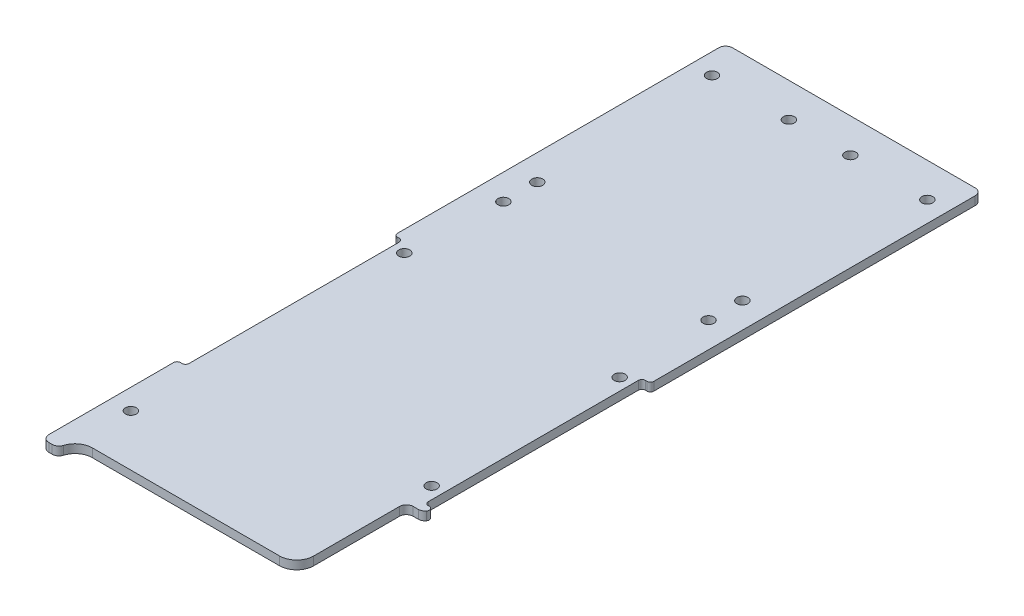
from build123d import *

# Parameters (mm, degrees)
SKETCH1_R               = 2.032
BOSS_EXTRUDE1_DEPTH     = 3.175
FILLET1_R               = 2.54
FILLET2_R               = 2.54
FILLET3_R               = 6.35
CUT_EXTRUDE1_DEPTH      = 136.673215063
FILLET4_R               = 6.35
FILLET5_R               = 2.54
SKETCH3_R               = 2.032
CUT_EXTRUDE2_DEPTH      = 136.673215063
CUT_EXTRUDE3_DEPTH      = 136.673215063
CUT_EXTRUDE3_DEPTH_BACK = 136.673215063
SKETCH4_W               = 3.175
SKETCH4_H               = 80.645
FILLET6_R               = 1.27


with BuildPart() as part:
    # Sketch1 → Boss-Extrude1 (new body)
    with BuildSketch(Plane(origin=(0, 0, 0), x_dir=(1, 0, 0), z_dir=(0, 1, 0))):
        Polygon((47.625, 127), (-47.625, 127), (-47.625, -127), (-41.275, -127), (-41.275, -120.65), (41.275, -120.65), (41.275, -127), (47.625, -127), align=None)
        with Locations(Location((-39.999684148, -101.6, 0), (0, 0, 270))):
            Circle(SKETCH1_R, mode=Mode.SUBTRACT)
        with Locations(Location((39.999684148, -69.85, 0), (0, 0, 270))):
            Circle(SKETCH1_R, mode=Mode.SUBTRACT)
        with Locations(Location((-39.999684148, 0, 0), (0, 0, 270))):
            Circle(SKETCH1_R, mode=Mode.SUBTRACT)
        with Locations(Location((-39.999684148, 114.3, 0), (0, 0, 270))):
            Circle(SKETCH1_R, mode=Mode.SUBTRACT)
        with Locations(Location((-11.424684148, 114.3, 0), (0, 0, 270))):
            Circle(SKETCH1_R, mode=Mode.SUBTRACT)
        with Locations(Location((39.999684148, 0, 0), (0, 0, 270))):
            Circle(SKETCH1_R, mode=Mode.SUBTRACT)
        with Locations(Location((11.424684148, 114.3, 0), (0, 0, 270))):
            Circle(SKETCH1_R, mode=Mode.SUBTRACT)
        with Locations(Location((39.999684148, 114.3, 0), (0, 0, 270))):
            Circle(SKETCH1_R, mode=Mode.SUBTRACT)
    extrude(amount=BOSS_EXTRUDE1_DEPTH)

    # Fillet1
    fillet1_edges = [part.edges().sort_by_distance(p)[0] for p in [
        (-47.625, 1.5875, 127),
        (-47.625, 1.5875, -127),
        (47.625, 1.5875, -127),
        (47.625, 1.5875, 127),
    ]]
    fillet(fillet1_edges, radius=FILLET1_R)

    # Fillet2
    fillet2_edges = [part.edges().sort_by_distance(p)[0] for p in [
        (-41.275, 1.5875, 127),
        (41.275, 1.5875, 127),
    ]]
    fillet(fillet2_edges, radius=FILLET2_R)

    # Fillet3
    fillet3_edges = [part.edges().sort_by_distance(p)[0] for p in [
        (41.275, 1.5875, 120.65),
        (-41.275, 1.5875, 120.65),
    ]]
    fillet(fillet3_edges, radius=FILLET3_R)

    # Sketch2 → Cut-Extrude1 (cut, through all)
    with BuildSketch(Plane.XZ):
        with BuildLine():
            Line((40.64508, 123.578690235), (40.64508, 79.88808))
            Line((40.64508, 79.88808), (47.625, 79.88808))
            Line((47.625, 79.88808), (47.625, 124.46))
            ThreePointArc((47.625, 124.46), (46.881051224, 126.256051224), (45.085, 127))
            Line((45.085, 127), (43.815, 127))
            ThreePointArc((43.815, 127), (42.297059666, 126.496530663), (41.380880287, 125.185714286))
            ThreePointArc((41.380880287, 125.185714286), (41.069166069, 124.356476684), (40.64508, 123.578690235))
        make_face()
    extrude(amount=-CUT_EXTRUDE1_DEPTH, mode=Mode.SUBTRACT)

    # Fillet4
    fillet4_edges = [part.edges().sort_by_distance(p)[0] for p in [
        (40.64508, 1.5875, 123.578690235),
    ]]
    fillet(fillet4_edges, radius=FILLET4_R)

    # Fillet5
    fillet5_edges = [part.edges().sort_by_distance(p)[0] for p in [
        (47.625, 1.5875, 79.88808),
        (40.64508, 1.5875, 79.88808),
    ]]
    fillet(fillet5_edges, radius=FILLET5_R)

    # Sketch3 → Cut-Extrude2 (cut, through all)
    with BuildSketch(Plane.XZ):
        with Locations(Location((-38.103460155, -34.913768806, 0), (0, 0, 270))):
            Circle(SKETCH3_R)
        with Locations(Location((-38.103460155, -47.490173279, 0), (0, 0, 270))):
            Circle(SKETCH3_R)
        with Locations(Location((38.103460155, -47.490173279, 0), (0, 0, 90))):
            Circle(SKETCH3_R)
        with Locations(Location((38.103460155, -34.913768806, 0), (0, 0, 90))):
            Circle(SKETCH3_R)
    extrude(amount=-CUT_EXTRUDE2_DEPTH, mode=Mode.SUBTRACT)

    # Sketch4 → Cut-Extrude3 (cut, two sides: drawn at the far end of the back side and taken through both)
    with BuildSketch(Plane(origin=(0, 3.175, 0), x_dir=(1, 0, 0), z_dir=(0, 1, 0)).offset(-CUT_EXTRUDE3_DEPTH_BACK)):
        with Locations((-46.0375, -36.5125)):
            Rectangle(SKETCH4_W, SKETCH4_H)
        with Locations((46.0375, -36.5125)):
            Rectangle(SKETCH4_W, SKETCH4_H)
    extrude(amount=CUT_EXTRUDE3_DEPTH + CUT_EXTRUDE3_DEPTH_BACK, mode=Mode.SUBTRACT)

    # Fillet6
    fillet6_edges = [part.edges().sort_by_distance(p)[0] for p in [
        (-44.45, 1.5875, -3.81),
        (-47.625, 1.5875, -3.81),
        (-47.625, 1.5875, 76.835),
        (-44.45, 1.5875, 76.835),
        (44.45, 1.5875, 76.835),
        (47.625, 1.5875, 76.835),
        (44.45, 1.5875, -3.81),
        (47.625, 1.5875, -3.81),
    ]]
    fillet(fillet6_edges, radius=FILLET6_R)


solid = part.part
